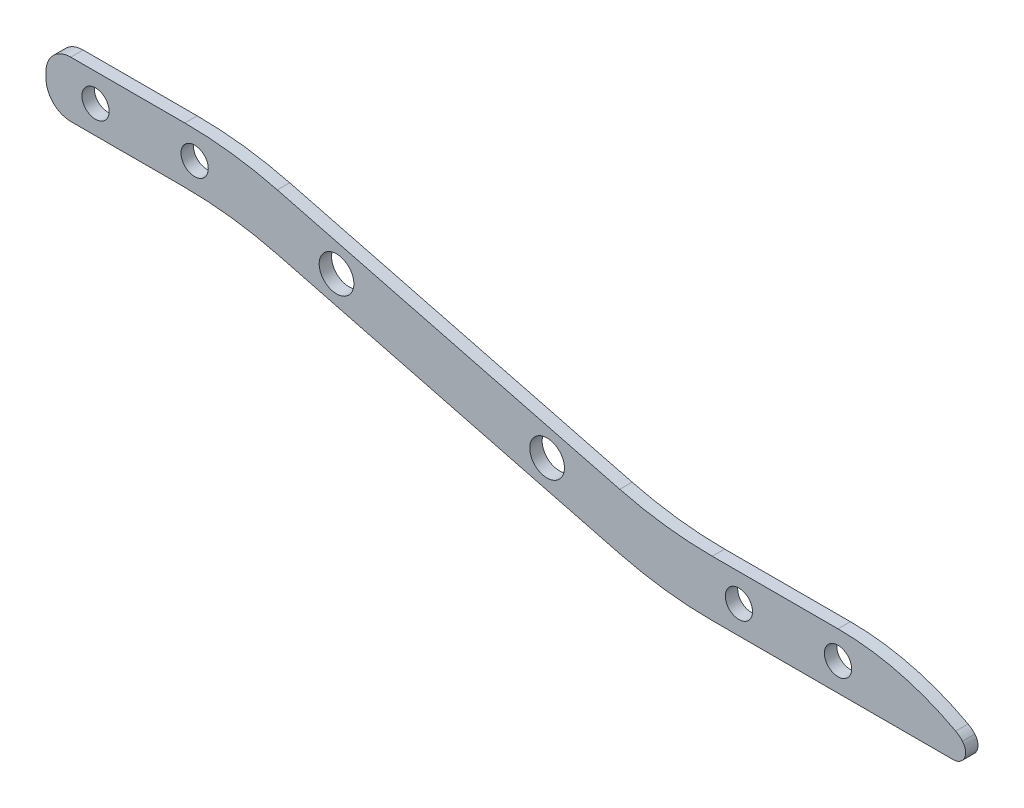
from build123d import *

# Parameters (mm, degrees)
SKETCH_2_R          = 1.1
EXTRUDE_1_DEPTH     = 1
SKETCH_4_R          = 1.4
CUT_EXTRUDE_1_DEPTH = 38.745650692


with BuildPart() as part:
    # 草图2 → 凸台-拉伸1 (new body)
    with BuildSketch(Plane.XY):
        with BuildLine():
            Line((9.2004412, -1.304787978), (-18.44790974, 5.804787978))
            ThreePointArc((-18.44790974, 5.804787978), (-22.15374848, 6.512758939), (-25.919140934, 6.75))
            Line((-25.919140934, 6.75), (-35.12373427, 6.75))
            ThreePointArc((-35.12373427, 6.75), (-36.537947832, 6.164213562), (-37.12373427, 4.75))
            Line((-37.12373427, 4.75), (-37.12373427, 4.25))
            ThreePointArc((-37.12373427, 4.25), (-36.537947832, 2.835786438), (-35.12373427, 2.25))
            Line((-35.12373427, 2.25), (-25.92398706, 2.25))
            ThreePointArc((-25.92398706, 2.25), (-22.153862686, 2.012159905), (-18.443517429, 1.302410814))
            Line((-18.443517429, 1.302410814), (9.149963579, -5.802410814))
            ThreePointArc((9.149963579, -5.802410814), (12.860308836, -6.512159905), (16.63043321, -6.75))
            Line((16.63043321, -6.75), (36.12373427, -6.75))
            ThreePointArc((36.12373427, -6.75), (37.035192863, -6.161391824), (36.873667496, -5.088486466))
            ThreePointArc((36.873667496, -5.088486466), (36.618179656, -4.845779883), (36.32405992, -4.651681705))
            ThreePointArc((36.32405992, -4.651681705), (31.722166726, -2.859714212), (26.821471158, -2.25))
            Line((26.821471158, -2.25), (16.671672394, -2.25))
            ThreePointArc((16.671672394, -2.25), (12.90627994, -2.012758939), (9.2004412, -1.304787978))
        make_face()
        with Locations((26.821471158, -4.5)):
            Circle(SKETCH_2_R, mode=Mode.SUBTRACT)
        with Locations((18.821471158, -4.5)):
            Circle(SKETCH_2_R, mode=Mode.SUBTRACT)
        with Locations((-25.12373427, 4.5)):
            Circle(SKETCH_2_R, mode=Mode.SUBTRACT)
        with Locations((-33.125142276, 4.5)):
            Circle(SKETCH_2_R, mode=Mode.SUBTRACT)
    extrude(amount=EXTRUDE_1_DEPTH)

    # 草图4 → 切除-拉伸1 (cut, through all)
    with BuildSketch(Plane.XY.offset(1)):
        with Locations((-13.6677648, 2.324207374)):
            Circle(SKETCH_4_R)
        with Locations((3.3322352, -2.049984423)):
            Circle(SKETCH_4_R)
    extrude(amount=-CUT_EXTRUDE_1_DEPTH, mode=Mode.SUBTRACT)


solid = part.part
